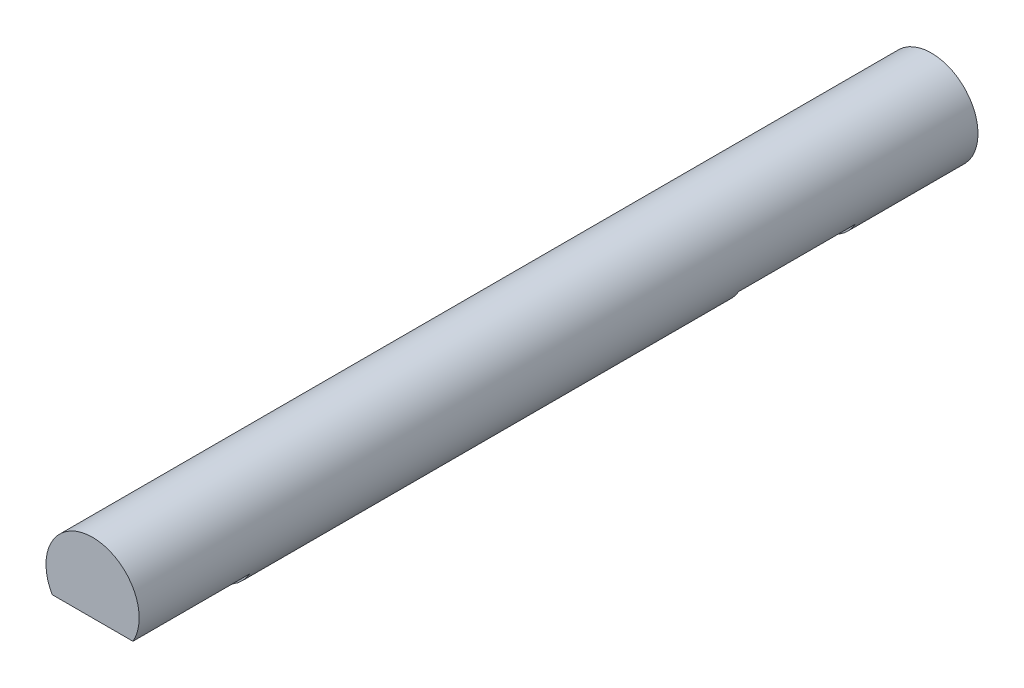
from build123d import *

# Parameters (mm, degrees)
SKETCH1_R           = 2
BOSS_EXTRUDE1_DEPTH = 36
CUT_EXTRUDE1_START  = -5
CUT_EXTRUDE1_DEPTH  = 5
CUT_EXTRUDE2_DEPTH  = 5


with BuildPart() as part:
    # Sketch1 → Boss-Extrude1 (new body)
    with BuildSketch(Plane.XY):
        Circle(SKETCH1_R)
    extrude(amount=BOSS_EXTRUDE1_DEPTH)

    # Sketch2 → Cut-Extrude1 (cut)
    with BuildSketch(Plane.XY.offset(36).offset(CUT_EXTRUDE1_START)):
        with BuildLine():
            Line((-1.732050808, -1), (1.732050808, -1))
            ThreePointArc((1.732050808, -1), (0, -2), (-1.732050808, -1))
        make_face()
    extrude(amount=CUT_EXTRUDE1_DEPTH, mode=Mode.SUBTRACT)

    # Sketch3 → Cut-Extrude2 (cut)
    with BuildSketch(Plane(origin=(0, 0, 5), x_dir=(-1, 0, 0), z_dir=(0, 0, -1))):
        with BuildLine():
            Line((1.732050808, -1), (-1.732050808, -1))
            ThreePointArc((-1.732050808, -1), (0, -2), (1.732050808, -1))
        make_face()
    extrude(amount=-CUT_EXTRUDE2_DEPTH, mode=Mode.SUBTRACT)


solid = part.part
